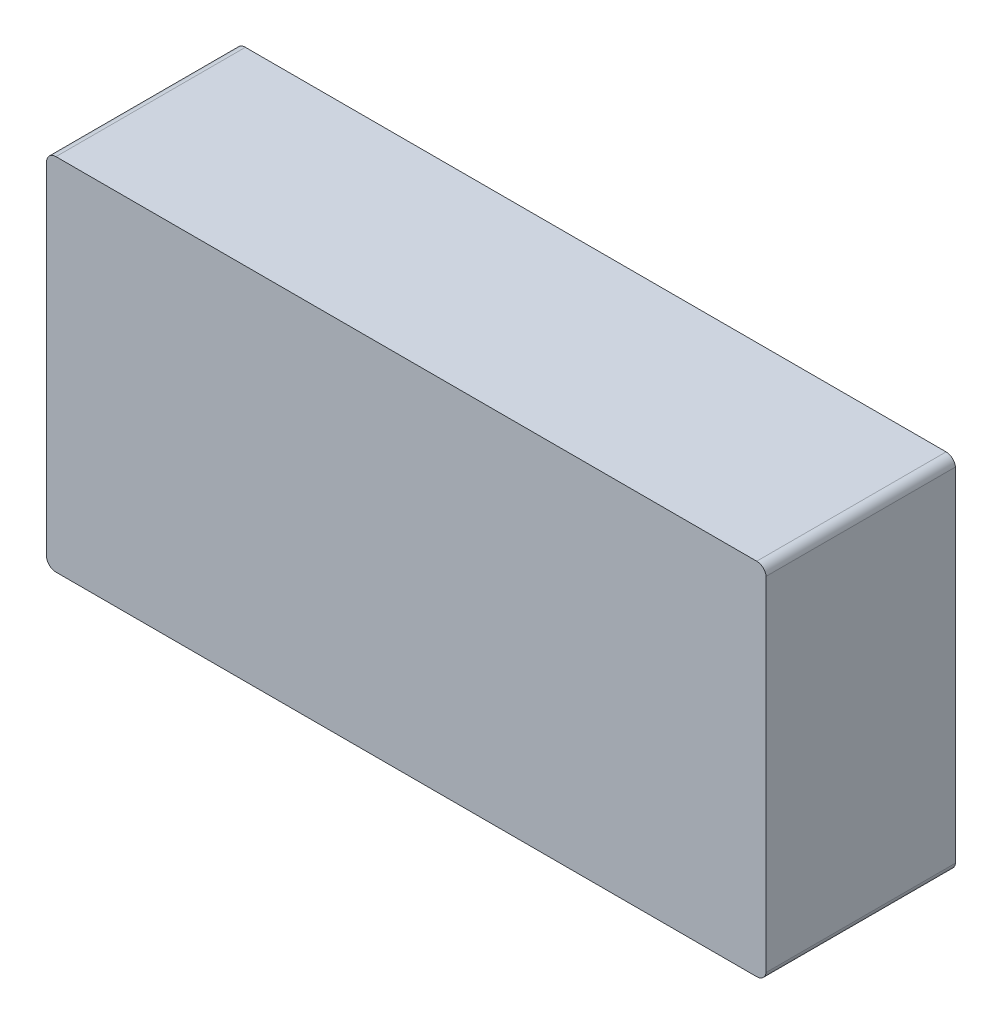
from build123d import *

# Parameters (mm, degrees)
SKETCH_1_W          = 38
SKETCH_1_H          = 19
EXTRUDE_1_DEPTH     = 10
SKETCH_2_W          = 1.5
SKETCH_2_H          = 9
EXTRUDE_2_DEPTH     = 9
SKETCH_3_R          = 1.5
CUT_EXTRUDE_1_DEPTH = 52.322509681
FILLET_2_R          = 0.5
CUT_EXTRUDE_2_DEPTH = 1
SKETCH_5_W          = 59.581818612
SKETCH_5_H          = 24.32156281
SKETCH_5_W_2        = 37.996651515
SKETCH_5_H_2        = 19
CUT_EXTRUDE_3_DEPTH = 52.672042731


with BuildPart() as part:
    # 草图1 → 凸台-拉伸1 (new body)
    with BuildSketch(Plane.XY):
        with Locations((19, 9.5)):
            Rectangle(SKETCH_1_W, SKETCH_1_H)
    extrude(amount=EXTRUDE_1_DEPTH)

    # 草图2 → 凸台-拉伸2 (add)
    with BuildSketch(Plane(origin=(38, 0, 0), x_dir=(0, 0, -1), z_dir=(1, 0, 0))):
        with Locations((-2.75, 9.5)):
            Rectangle(SKETCH_2_W, SKETCH_2_H)
    extrude_2 = extrude(amount=EXTRUDE_2_DEPTH)

    # 草图3 → 切除-拉伸1 (cut, through all)
    with BuildSketch(Plane(origin=(0, 0, 2), x_dir=(-1, 0, 0), z_dir=(0, 0, -1))):
        with Locations((-42.5, 9.5)):
            Circle(SKETCH_3_R)
    cut_extrude_1 = extrude(amount=-CUT_EXTRUDE_1_DEPTH, mode=Mode.SUBTRACT)

    # 镜向3: 凸台-拉伸2, 切除-拉伸1 across plane
    add(extrude_2.mirror(Plane(origin=(19, 0, 0), x_dir=(0, 0, 1), z_dir=(1, 0, 0))))
    add(cut_extrude_1.mirror(Plane(origin=(19, 0, 0), x_dir=(0, 0, 1), z_dir=(1, 0, 0))), mode=Mode.SUBTRACT)

    # 圆角2
    fillet_2_edges = [part.edges().sort_by_distance(p)[0] for p in [
        (38, 5, 2.75),
        (38, 14, 2.75),
        (47, 5, 2.75),
        (47, 14, 2.75),
        (-9, 14, 2.75),
        (-9, 5, 2.75),
        (0, 5, 2.75),
        (0, 14, 2.75),
        (0, 19, 5),
        (38, 19, 5),
        (38, 0, 5),
        (0, 0, 5),
    ]]
    fillet(fillet_2_edges, radius=FILLET_2_R)

    # 草图4 → 切除-拉伸2 (cut)
    with BuildSketch(Plane(origin=(0, 0, 0), x_dir=(-1, 0, 0), z_dir=(0, 0, -1))):
        with BuildLine():
            Line((-30, 13.5), (-8, 13.5))
            ThreePointArc((-8, 13.5), (-4, 9.5), (-8, 5.5))
            Line((-8, 5.5), (-30, 5.5))
            ThreePointArc((-30, 5.5), (-34, 9.5), (-30, 13.5))
        make_face()
    extrude(amount=-CUT_EXTRUDE_2_DEPTH, mode=Mode.SUBTRACT)

    # 草图5 → 切除-拉伸3 (cut, through all)
    with BuildSketch(Plane(origin=(0, 0, 0), x_dir=(-1, 0, 0), z_dir=(0, 0, -1))):
        with Locations((-19.067430593, 9.084908835)):
            Rectangle(SKETCH_5_W, SKETCH_5_H)
        with Locations((-18.998325758, 9.5)):
            Rectangle(SKETCH_5_W_2, SKETCH_5_H_2, mode=Mode.SUBTRACT)
    extrude(amount=-CUT_EXTRUDE_3_DEPTH, mode=Mode.SUBTRACT)


solid = part.part
